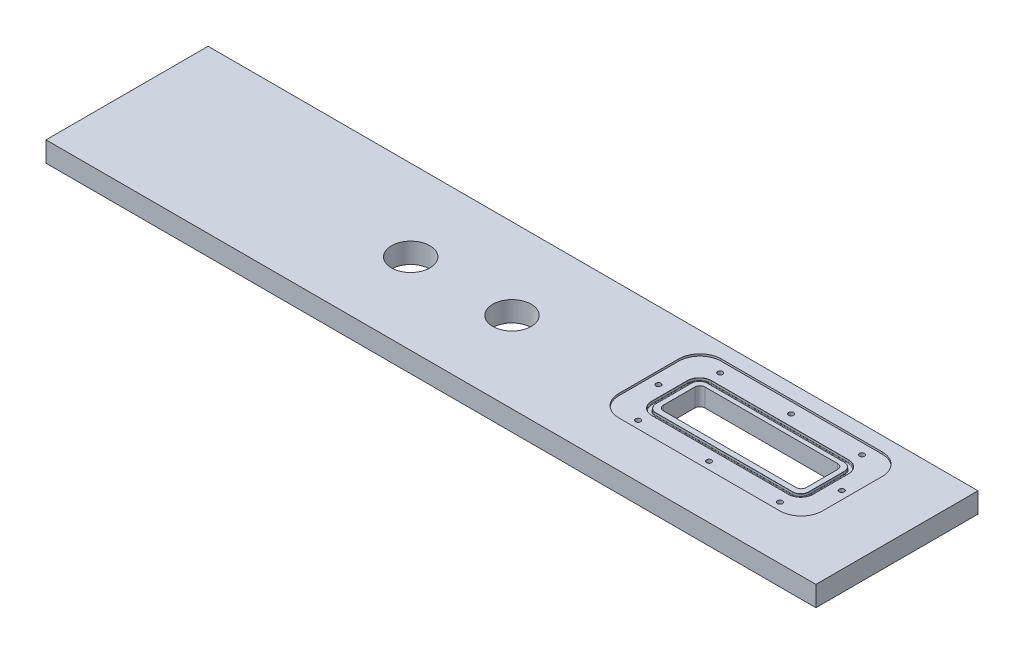
from build123d import *

# Parameters (mm, degrees)
SKETCH_1_W             = 760
SKETCH_1_H             = 160
EXTRUDE_1_DEPTH        = 10
SKETCH_2_R             = 19
CUT_EXTRUDE_1_DEPTH    = 777.916983982
CUT_EXTRUDE_2_DEPTH    = 2
CUT_EXTRUDE_4_DEPTH    = 2.7
CUT_EXTRUDE_5_DEPTH    = 777.868071168
HOLE_WIZARD_M6_1_D     = 5
HOLE_WIZARD_M6_1_DEPTH = 15
HOLE_WIZARD_M6_1_TIP   = 1.502151548
FILLET_1_R             = 0.13
FILLET_2_R             = 0.5
FILLET_3_R             = 0.5
FILLET_4_R             = 0.13


with BuildPart() as part:
    # 스케치1 → 보스-돌출1 (new, symmetric)
    with BuildSketch(Plane(origin=(0, 0, 0), x_dir=(1, 0, 0), z_dir=(0, 1, 0))):
        with Locations((380, 80)):
            Rectangle(SKETCH_1_W, SKETCH_1_H)
    extrude(amount=EXTRUDE_1_DEPTH, both=True)

    # 스케치2 → 컷-돌출1 (cut, through all)
    with BuildSketch(Plane(origin=(0, 10, 0), x_dir=(1, 0, 0), z_dir=(0, 1, 0))):
        with Locations(Location((280, 80, 0), (0, 0, 270))):
            Circle(SKETCH_2_R)
        with Locations(Location((380, 80, 0), (0, 0, 270))):
            Circle(SKETCH_2_R)
    extrude(amount=-CUT_EXTRUDE_1_DEPTH, mode=Mode.SUBTRACT)

    # 스케치3 → 컷-돌출2 (cut)
    with BuildSketch(Plane(origin=(0, 10, 0), x_dir=(1, 0, 0), z_dir=(0, 1, 0))):
        with BuildLine():
            Line((520.5, 146), (679.5, 146))
            ThreePointArc((679.5, 146), (694.349242405, 139.849242405), (700.5, 125))
            Line((700.5, 125), (700.5, 66))
            ThreePointArc((700.5, 66), (694.349242405, 51.150757595), (679.5, 45))
            Line((679.5, 45), (520.5, 45))
            ThreePointArc((520.5, 45), (505.650757595, 51.150757595), (499.5, 66))
            Line((499.5, 66), (499.5, 125))
            ThreePointArc((499.5, 125), (505.650757595, 139.849242405), (520.5, 146))
        make_face()
    extrude(amount=-CUT_EXTRUDE_2_DEPTH, mode=Mode.SUBTRACT)

    # 스케치4 → 컷-돌출4 (cut)
    with BuildSketch(Plane(origin=(0, 8, 0), x_dir=(1, 0, 0), z_dir=(0, 1, 0))):
        with BuildLine():
            Line((532.5, 124.55), (667.5, 124.55))
            ThreePointArc((667.5, 124.55), (676.020636713, 121.020636713), (679.55, 112.5))
            Line((679.55, 112.5), (679.55, 77.5))
            ThreePointArc((679.55, 77.5), (676.020636713, 68.979363287), (667.5, 65.45))
            Line((667.5, 65.45), (532.5, 65.45))
            ThreePointArc((532.5, 65.45), (523.979363287, 68.979363287), (520.45, 77.5))
            Line((520.45, 77.5), (520.45, 112.5))
            ThreePointArc((520.45, 112.5), (523.979363287, 121.020636713), (532.5, 124.55))
        make_face()
        with BuildLine():
            Line((532.5, 120.45), (667.5, 120.45))
            ThreePointArc((667.5, 120.45), (673.12149891, 118.12149891), (675.45, 112.5))
            Line((675.45, 112.5), (675.45, 77.5))
            ThreePointArc((675.45, 77.5), (673.12149891, 71.87850109), (667.5, 69.55))
            Line((667.5, 69.55), (532.5, 69.55))
            ThreePointArc((532.5, 69.55), (526.87850109, 71.87850109), (524.55, 77.5))
            Line((524.55, 77.5), (524.55, 112.5))
            ThreePointArc((524.55, 112.5), (526.87850109, 118.12149891), (532.5, 120.45))
        make_face(mode=Mode.SUBTRACT)
    extrude(amount=-CUT_EXTRUDE_4_DEPTH, mode=Mode.SUBTRACT)

    # 스케치5 → 컷-돌출5 (cut, through all)
    with BuildSketch(Plane(origin=(0, 8, 0), x_dir=(1, 0, 0), z_dir=(0, 1, 0))):
        with BuildLine():
            Line((534.5, 116), (665.5, 116))
            ThreePointArc((665.5, 116), (669.035533906, 114.535533906), (670.5, 111))
            Line((670.5, 111), (670.5, 80))
            ThreePointArc((670.5, 80), (669.035533906, 76.464466094), (665.5, 75))
            Line((665.5, 75), (534.5, 75))
            ThreePointArc((534.5, 75), (530.964466094, 76.464466094), (529.5, 80))
            Line((529.5, 80), (529.5, 111))
            ThreePointArc((529.5, 111), (530.964466094, 114.535533906), (534.5, 116))
        make_face()
    extrude(amount=-CUT_EXTRUDE_5_DEPTH, mode=Mode.SUBTRACT)

    # M6 나사 구멍1
    with Locations(Plane(origin=(0, 8, 0), x_dir=(1, 0, 0), z_dir=(0, 1, 0))):
        with Locations((530, 135.5), (600, 135.5), (670, 135.5), (670, 54.5), (600, 54.5), (530, 54.5), (509.5, 95), (690.5, 95)):
            Hole(HOLE_WIZARD_M6_1_D / 2, depth=HOLE_WIZARD_M6_1_DEPTH)
            with Locations((0, 0, -(HOLE_WIZARD_M6_1_DEPTH + HOLE_WIZARD_M6_1_TIP / 2))):  # 118° drill point
                Cone(0, HOLE_WIZARD_M6_1_D / 2, HOLE_WIZARD_M6_1_TIP, mode=Mode.SUBTRACT)

    # 필렛1
    fillet_1_edges = [part.edges().sort_by_distance(p)[0] for p in [
        (523.979363287, 8, -121.020636713),
        (520.45, 8, -95),
        (523.979363287, 8, -68.979363287),
        (600, 8, -65.45),
        (676.020636713, 8, -68.979363287),
        (679.55, 8, -95),
        (676.020636713, 8, -121.020636713),
        (600, 8, -124.55),
    ]]
    fillet(fillet_1_edges, radius=FILLET_1_R)

    # 필렛2
    fillet_2_edges = [part.edges().sort_by_distance(p)[0] for p in [
        (523.979363287, 5.3, -121.020636713),
        (600, 5.3, -124.55),
        (676.020636713, 5.3, -121.020636713),
        (679.55, 5.3, -95),
        (676.020636713, 5.3, -68.979363287),
        (600, 5.3, -65.45),
        (523.979363287, 5.3, -68.979363287),
        (520.45, 5.3, -95),
    ]]
    fillet(fillet_2_edges, radius=FILLET_2_R)

    # 필렛3
    fillet_3_edges = [part.edges().sort_by_distance(p)[0] for p in [
        (675.45, 5.3, -95),
        (673.12149891, 5.3, -118.12149891),
        (600, 5.3, -120.45),
        (526.87850109, 5.3, -118.12149891),
        (524.55, 5.3, -95),
        (526.87850109, 5.3, -71.87850109),
        (600, 5.3, -69.55),
        (673.12149891, 5.3, -71.87850109),
    ]]
    fillet(fillet_3_edges, radius=FILLET_3_R)

    # 필렛4
    fillet_4_edges = [part.edges().sort_by_distance(p)[0] for p in [
        (673.12149891, 8, -118.12149891),
        (675.45, 8, -95),
        (673.12149891, 8, -71.87850109),
        (600, 8, -69.55),
        (526.87850109, 8, -71.87850109),
        (524.55, 8, -95),
        (526.87850109, 8, -118.12149891),
        (600, 8, -120.45),
    ]]
    fillet(fillet_4_edges, radius=FILLET_4_R)


solid = part.part
